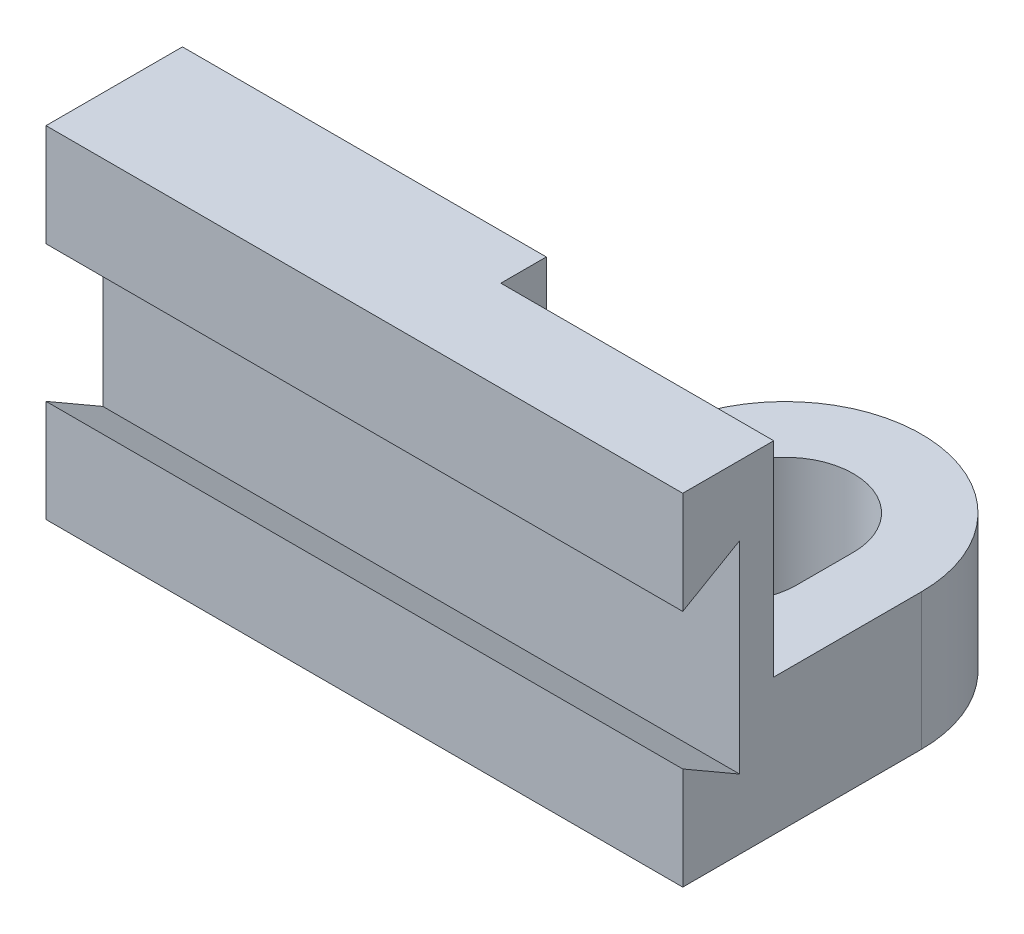
from build123d import *

# Parameters (mm, degrees)
EXTRUDE_1_DEPTH          = 30
CUT_EXTRUDE_1_DEPTH      = 65.652919501
CUT_EXTRUDE_1_DEPTH_BACK = 65.652919501
EXTRUDE_2_DEPTH          = 8
EXTRUDE_3_DEPTH          = 4


with BuildPart() as part:
    # 草图1 → 凸台-拉伸1 (new body)
    with BuildSketch(Plane(origin=(0, 0, 0), x_dir=(1, 0, 0), z_dir=(0, 1, 0))):
        Polygon((0, 0), (56, 0), (56, 8), (32, 8), (32, 12), (0, 12), align=None)
    extrude(amount=EXTRUDE_1_DEPTH)

    # 草图2 → 切除-拉伸1 (cut, two sides: drawn at the far end of the back side and taken through both)
    with BuildSketch(Plane.ZY.offset(-CUT_EXTRUDE_1_DEPTH_BACK)):
        Polygon((0, 15), (0, 15.000747226), (0, 21), (-5, 23.886751346), (-5, 6.11399588), (0, 9.000747226), align=None)
    extrude(amount=CUT_EXTRUDE_1_DEPTH + CUT_EXTRUDE_1_DEPTH_BACK, mode=Mode.SUBTRACT)

    # 草图5 → 凸台-拉伸2 (add)
    with BuildSketch(Plane.XZ):
        with BuildLine():
            Line((56, -8), (44, -8))
            Line((44, -8), (32, -8))
            Line((32, -8), (32, -12))
            Line((32, -12), (0, -12))
            Line((0, -12), (0, -20))
            Line((0, -20), (40.466636051, -32.468013743))
            ThreePointArc((40.466636051, -32.468013743), (51.127398986, -30.654024223), (56, -21))
            Line((56, -21), (56, -8))
        make_face()
        with BuildLine():
            ThreePointArc((38, -16), (39.757359313, -11.757359313), (44, -10))
            ThreePointArc((44, -10), (48.242640687, -11.757359313), (50, -16))
            Line((50, -16), (50, -21))
            ThreePointArc((50, -21), (44, -27), (38, -21))
            Line((38, -21), (38, -16))
        make_face(mode=Mode.SUBTRACT)
    extrude(amount=-EXTRUDE_2_DEPTH)

    # 草图6 → 凸台-拉伸3 (add)
    with BuildSketch(Plane(origin=(0, 8, 0), x_dir=(1, 0, 0), z_dir=(0, 1, 0))):
        with BuildLine():
            Line((32, 21), (32, 8))
            Line((32, 8), (56, 8))
            Line((56, 8), (56, 21))
            ThreePointArc((56, 21), (44, 33), (32, 21))
        make_face()
        with BuildLine():
            Line((38, 21), (38, 16))
            ThreePointArc((38, 16), (44, 10), (50, 16))
            Line((50, 16), (50, 21))
            ThreePointArc((50, 21), (44, 27), (38, 21))
        make_face(mode=Mode.SUBTRACT)
    extrude(amount=EXTRUDE_3_DEPTH)


solid = part.part
